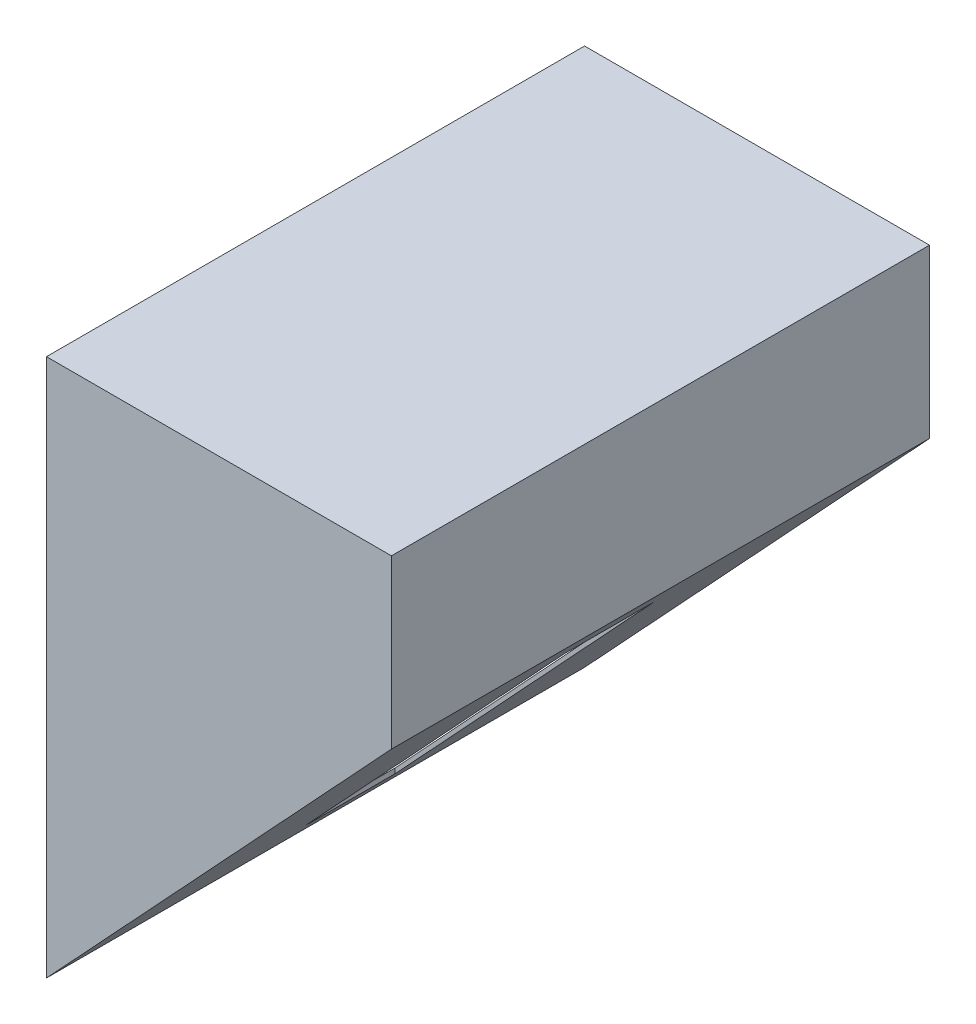
from build123d import *

# Parameters (mm, degrees)
ESQUISSE1_W              = 156
ESQUISSE1_H              = 156
BOSS_EXTRU_3_DEPTH       = 100
ESQUISSE5_W              = 75
ESQUISSE5_H              = 26
ENL_V_MAT_EXTRU_4_DEPTH  = 100
ENL_V_MAT_EXTRU_11_DEPTH = 217.60592354
COQUE6_T                 = -1
ENL_V_MAT_EXTRU_12_REACH = 178.199


with BuildPart() as part:
    # Esquisse1 → Boss.-Extru.3 (new body)
    with BuildSketch(Plane(origin=(0, 0, 0), x_dir=(0, 0, -1), z_dir=(1, 0, 0))):
        with Locations((-3, -34.170076726)):
            Rectangle(ESQUISSE1_W, ESQUISSE1_H)
    extrude(amount=BOSS_EXTRU_3_DEPTH)

    # Esquisse5 → Enlèv. mat.-Extru.4 (cut)
    with BuildSketch(Plane.XZ.offset(112.170076726)):
        with Locations((47.5, 3)):
            Rectangle(ESQUISSE5_W, ESQUISSE5_H)
    extrude(amount=-ENL_V_MAT_EXTRU_4_DEPTH, mode=Mode.SUBTRACT)

    # Esquisse8 → Enlèv. mat.-Extru.11 (cut, through all)
    with BuildSketch(Plane.XY.offset(81)):
        Polygon((100, -4.709521913), (0, -112.170076726), (100, -112.170076726), align=None)
    extrude(amount=-ENL_V_MAT_EXTRU_11_DEPTH, mode=Mode.SUBTRACT)

    # Coque6
    coque6_openings = [part.faces().sort_by_distance(p)[0] for p in [
        (0, -34.170076726, 3),
    ]]
    offset(amount=COQUE6_T, openings=coque6_openings, kind=Kind.INTERSECTION)

    # Esquisse10 → Enlèv. mat.-Extru.12 (cut, up to next)
    with BuildSketch(Plane(origin=(0, 0, -11), x_dir=(-1, 0, 0), z_dir=(0, 0, -1)), mode=Mode.PRIVATE) as enl_v_mat_extru_12_sk1:
        Polygon((-9, -101.030710895), (-86, -18.286083689), (-86, -11.170076726), (-9, -11.170076726), align=None)
    enl_v_mat_extru_12_tool1 = extrude(enl_v_mat_extru_12_sk1.sketch, amount=-ENL_V_MAT_EXTRU_12_REACH, mode=Mode.PRIVATE) & part.part
    add(enl_v_mat_extru_12_tool1.solids().sort_by_distance((36.55005, -41.297676, -11))[0], mode=Mode.SUBTRACT)


solid = part.part
